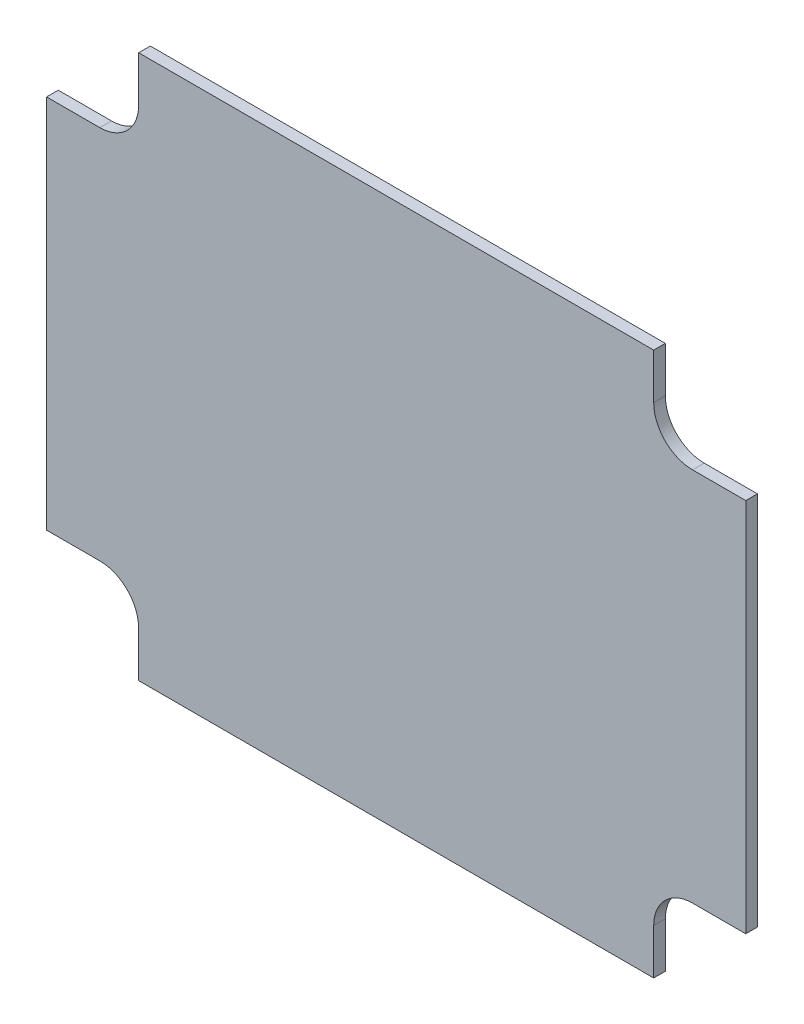
from build123d import *

# Parameters (mm, degrees)
SKETCH_3_W      = 66.3
SKETCH_3_H      = 48.3
SKETCH_3_W_2    = 11.85
SKETCH_3_H_2    = 10.85
EXTRUDE_1_DEPTH = 1.5
FILLET_1_R      = 5


with BuildPart() as part:
    # 草图3 → 凸台-拉伸1 (new body)
    with BuildSketch(Plane.XY):
        with Locations((-0.073737011, -0.836272376)):
            Rectangle(SKETCH_3_W, SKETCH_3_H)
        with Locations((-39.148737011, -0.836272376)):
            Rectangle(SKETCH_3_W_2, SKETCH_3_H)
        with Locations((-0.073737011, -30.411272376)):
            Rectangle(SKETCH_3_W, SKETCH_3_H_2)
        with Locations((-0.073737011, 28.738727624)):
            Rectangle(SKETCH_3_W, SKETCH_3_H_2)
        with Locations((39.001262989, -0.836272376)):
            Rectangle(SKETCH_3_W_2, SKETCH_3_H)
    extrude(amount=EXTRUDE_1_DEPTH)

    # 圆角1
    fillet_1_edges = [part.edges().sort_by_distance(p)[0] for p in [
        (33.076262989, 23.313727624, 0.75),
        (33.076262989, -24.986272376, 0.75),
        (-33.223737011, -24.986272376, 0.75),
        (-33.223737011, 23.313727624, 0.75),
    ]]
    fillet(fillet_1_edges, radius=FILLET_1_R)


solid = part.part
